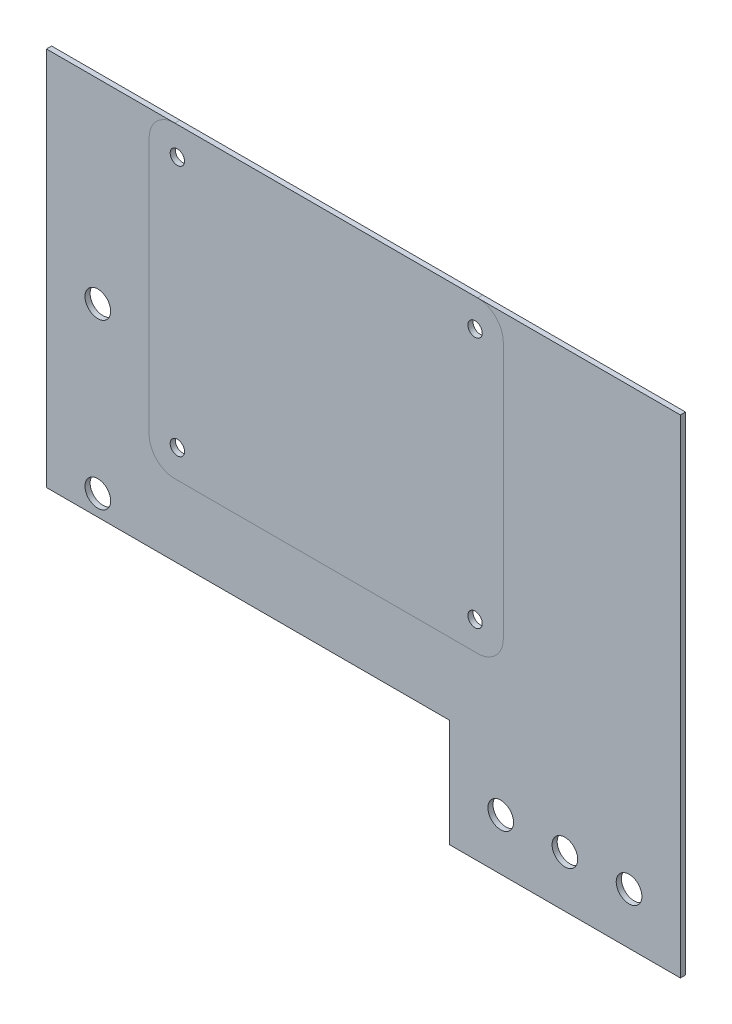
from build123d import *

# Parameters (mm, degrees)
BOSS_EXTRUDE1_DEPTH      = 6.5
BOSS_EXTRUDE1_DEPTH_BACK = 1
SKETCH5_R                = 3
SKETCH5_R_2              = 1.4
BOSS_EXTRUDE5_DEPTH      = 3.2
BOSS_EXTRUDE5_2_DEPTH    = 3.2
BOSS_EXTRUDE5_3_DEPTH    = 3.2
BOSS_EXTRUDE5_4_DEPTH    = 3.2
BOSS_EXTRUDE6_START      = -1.3
BOSS_EXTRUDE6_DEPTH      = 1.3
CUT_EXTRUDE9_START       = -1.5
SKETCH17_R               = 1.4
CUT_EXTRUDE9_DEPTH       = 1.5
CUT_EXTRUDE10_DEPTH      = 10
CUT_EXTRUDE10_DEPTH_BACK = 3.5
SKETCH18_W               = 118.483225972
SKETCH18_H               = 113.092379331
SKETCH23_R               = 2.5
BOSS_EXTRUDE7_DEPTH      = 1


with BuildPart() as part:
    # Sketch3 → Boss-Extrude1 (new, two sides: drawn at the far end of the back side and taken through both)
    with BuildSketch(Plane.XY.offset(55.290865561).offset(-BOSS_EXTRUDE1_DEPTH_BACK)):
        with BuildLine():
            Line((-23.272824317, 59.357808031), (-23.272824317, 9.357808031))
            ThreePointArc((-23.272824317, 9.357808031), (-21.808358223, 5.822274126), (-18.272824317, 4.357808031))
            Line((-18.272824317, 4.357808031), (40.727175683, 4.357808031))
            ThreePointArc((40.727175683, 4.357808031), (44.262709589, 5.822274126), (45.727175683, 9.357808031))
            Line((45.727175683, 9.357808031), (45.727175683, 59.357808031))
            ThreePointArc((45.727175683, 59.357808031), (44.262709589, 62.893341937), (40.727175683, 64.357808031))
            Line((40.727175683, 64.357808031), (-18.272824317, 64.357808031))
            ThreePointArc((-18.272824317, 64.357808031), (-21.808358223, 62.893341937), (-23.272824317, 59.357808031))
        make_face()
        with BuildLine():
            Line((40.727175683, 62.857808031), (-18.272824317, 62.857808031))
            ThreePointArc((-18.272824317, 62.857808031), (-20.747698051, 61.832681766), (-21.772824317, 59.357808031))
            Line((-21.772824317, 59.357808031), (-21.772824317, 9.357808031))
            ThreePointArc((-21.772824317, 9.357808031), (-20.747698051, 6.882934297), (-18.272824317, 5.857808031))
            Line((-18.272824317, 5.857808031), (40.727175683, 5.857808031))
            ThreePointArc((40.727175683, 5.857808031), (43.202049418, 6.882934297), (44.227175683, 9.357808031))
            Line((44.227175683, 9.357808031), (44.227175683, 59.357808031))
            ThreePointArc((44.227175683, 59.357808031), (43.202049418, 61.832681766), (40.727175683, 62.857808031))
        make_face(mode=Mode.SUBTRACT)
    extrude(amount=BOSS_EXTRUDE1_DEPTH + BOSS_EXTRUDE1_DEPTH_BACK)



with BuildPart() as body_2:
    # Sketch5 → Boss-Extrude5 (new body)
    with BuildSketch(Plane.XY.offset(55.290865561)):
        with Locations((-17.772824317, 58.857808031)):
            Circle(SKETCH5_R)
        with Locations(Location((-17.772824317, 58.857808031, 0), (0, 0, 180))):
            Circle(SKETCH5_R_2, mode=Mode.SUBTRACT)
    extrude(amount=BOSS_EXTRUDE5_DEPTH)


with BuildPart() as body_3:
    # Sketch5 → Boss-Extrude5 2 (new body)
    with BuildSketch(Plane.XY.offset(55.290865561)):
        with Locations(Location((40.227175683, 58.857808031, 0), (0, 0, 180))):
            Circle(SKETCH5_R)
        with Locations((40.227175683, 58.857808031)):
            Circle(SKETCH5_R_2, mode=Mode.SUBTRACT)
    extrude(amount=BOSS_EXTRUDE5_2_DEPTH)


with BuildPart() as body_4:
    # Sketch5 → Boss-Extrude5 3 (new body)
    with BuildSketch(Plane.XY.offset(55.290865561)):
        with Locations(Location((-17.772824317, 9.857808031, 0), (0, 0, 180))):
            Circle(SKETCH5_R)
        with Locations((-17.772824317, 9.857808031)):
            Circle(SKETCH5_R_2, mode=Mode.SUBTRACT)
    extrude(amount=BOSS_EXTRUDE5_3_DEPTH)


with BuildPart() as body_5:
    # Sketch5 → Boss-Extrude5 4 (new body)
    with BuildSketch(Plane.XY.offset(55.290865561)):
        with Locations((40.227175683, 9.857808031)):
            Circle(SKETCH5_R)
        with Locations(Location((40.227175683, 9.857808031, 0), (0, 0, 180))):
            Circle(SKETCH5_R_2, mode=Mode.SUBTRACT)
    extrude(amount=BOSS_EXTRUDE5_4_DEPTH)


with BuildPart() as part_1:
    add(part.part)

    add(body_2.part)  # Boss-Extrude6 merges body 2

    add(body_3.part)  # Boss-Extrude6 merges body 3

    add(body_4.part)  # Boss-Extrude6 merges body 4

    add(body_5.part)  # Boss-Extrude6 merges body 5
    # Sketch13 → Boss-Extrude6 (add)
    with BuildSketch(Plane.XY.offset(55.290865561).offset(BOSS_EXTRUDE6_START)):
        with BuildLine():
            Line((-23.272824317, 26.657808031), (-23.272824317, 42.657808031))
            Line((-23.272824317, 42.657808031), (-23.272824317, 59.357808031))
            ThreePointArc((-23.272824317, 59.357808031), (-21.808358223, 62.893341937), (-18.272824317, 64.357808031))
            Line((-18.272824317, 64.357808031), (40.727175683, 64.357808031))
            ThreePointArc((40.727175683, 64.357808031), (44.262709589, 62.893341937), (45.727175683, 59.357808031))
            Line((45.727175683, 59.357808031), (45.727175683, 9.357808031))
            ThreePointArc((45.727175683, 9.357808031), (44.262709589, 5.822274126), (40.727175683, 4.357808031))
            Line((40.727175683, 4.357808031), (-18.272824317, 4.357808031))
            ThreePointArc((-18.272824317, 4.357808031), (-21.808358223, 5.822274126), (-23.272824317, 9.357808031))
            Line((-23.272824317, 9.357808031), (-23.272824317, 26.657808031))
        make_face()
    extrude(amount=BOSS_EXTRUDE6_DEPTH)

    # Sketch17 → Cut-Extrude9 (cut)
    with BuildSketch(Plane.XY.offset(55.290865561).offset(CUT_EXTRUDE9_START)):
        with Locations(Location((40.227175683, 9.857808031, 0), (0, 0, 180))):
            Circle(SKETCH17_R)
        with Locations((-17.772824317, 9.857808031)):
            Circle(SKETCH17_R)
        with Locations(Location((-17.772824317, 58.857808031, 0), (0, 0, 180))):
            Circle(SKETCH17_R)
        with Locations((40.227175683, 58.857808031)):
            Circle(SKETCH17_R)
    extrude(amount=CUT_EXTRUDE9_DEPTH, mode=Mode.SUBTRACT)

    # Sketch18 → Cut-Extrude10 (cut, two sides: drawn at the far end of the back side and taken through both)
    with BuildSketch(Plane.XY.offset(58.490865561).offset(-CUT_EXTRUDE10_DEPTH_BACK)):
        with Locations((8.738192824, 45.025275568)):
            Rectangle(SKETCH18_W, SKETCH18_H)
    extrude(amount=CUT_EXTRUDE10_DEPTH + CUT_EXTRUDE10_DEPTH_BACK, mode=Mode.SUBTRACT)


with BuildPart() as body_2_2:
    # Sketch23 → Boss-Extrude7 (new body)
    with BuildSketch(Plane.XY.offset(54.990865561)):
        with BuildLine():
            Line((-18.272824317, 64.357808031), (-43.272824317, 64.357808031))
            Line((-43.272824317, 64.357808031), (-43.272824317, -9.642191969))
            Line((-43.272824317, -9.642191969), (35.227175683, -9.642191969))
            Line((35.227175683, -9.642191969), (35.227175683, -30.642191969))
            Line((35.227175683, -30.642191969), (80.227175683, -30.642191969))
            Line((80.227175683, -30.642191969), (80.227175683, 64.357808031))
            Line((80.227175683, 64.357808031), (40.727175683, 64.357808031))
            ThreePointArc((40.727175683, 64.357808031), (44.262709589, 62.893341937), (45.727175683, 59.357808031))
            Line((45.727175683, 59.357808031), (45.727175683, 9.357808031))
            ThreePointArc((45.727175683, 9.357808031), (44.262709589, 5.822274126), (40.727175683, 4.357808031))
            Line((40.727175683, 4.357808031), (-18.272824317, 4.357808031))
            ThreePointArc((-18.272824317, 4.357808031), (-21.808358223, 5.822274126), (-23.272824317, 9.357808031))
            Line((-23.272824317, 9.357808031), (-23.272824317, 59.357808031))
            ThreePointArc((-23.272824317, 59.357808031), (-21.808358223, 62.893341937), (-18.272824317, 64.357808031))
        make_face()
        with Locations((-33.272824317, -5.642191969)):
            Circle(SKETCH23_R, mode=Mode.SUBTRACT)
        with Locations((45.227175683, -20.642191969)):
            Circle(SKETCH23_R, mode=Mode.SUBTRACT)
        with BuildLine():
            ThreePointArc((55.227175683, -20.642191969), (57.727175683, -18.142191969), (60.227175683, -20.642191969))
            ThreePointArc((60.227175683, -20.642191969), (57.727175683, -23.142191969), (55.227175683, -20.642191969))
        make_face(mode=Mode.SUBTRACT)
        with Locations((70.227175683, -20.642191969)):
            Circle(SKETCH23_R, mode=Mode.SUBTRACT)
        with Locations((-33.272824317, 26.357808031)):
            Circle(SKETCH23_R, mode=Mode.SUBTRACT)
    extrude(amount=-BOSS_EXTRUDE7_DEPTH)


solid = Compound([part_1.part, body_2_2.part])
